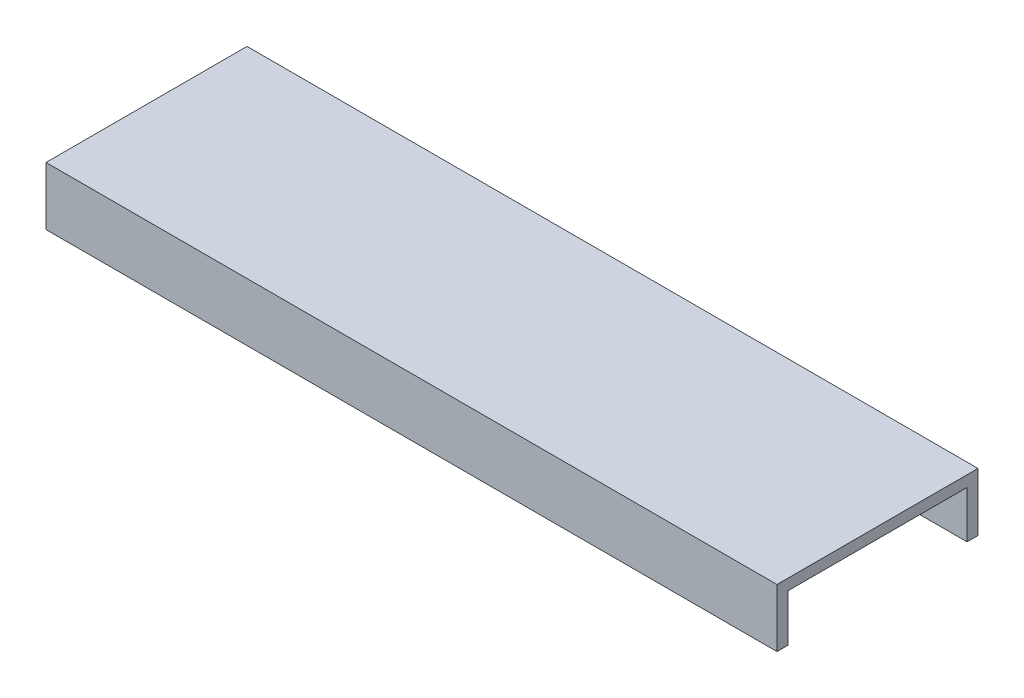
from build123d import *

# Parameters (mm, degrees)
EXTRUDE_1_DEPTH = 100


with BuildPart() as part:
    # 草图1 → 凸台-拉伸1 (new body)
    with BuildSketch(Plane(origin=(0, 0, 0), x_dir=(0, 0, -1), z_dir=(1, 0, 0))):
        Polygon((-13.75, 7.95), (-13.75, 0), (-12.25, 0), (-12.25, 6.45), (12.25, 6.45), (12.25, 0), (13.75, 0), (13.75, 7.95), align=None)
    extrude(amount=EXTRUDE_1_DEPTH)


solid = part.part
